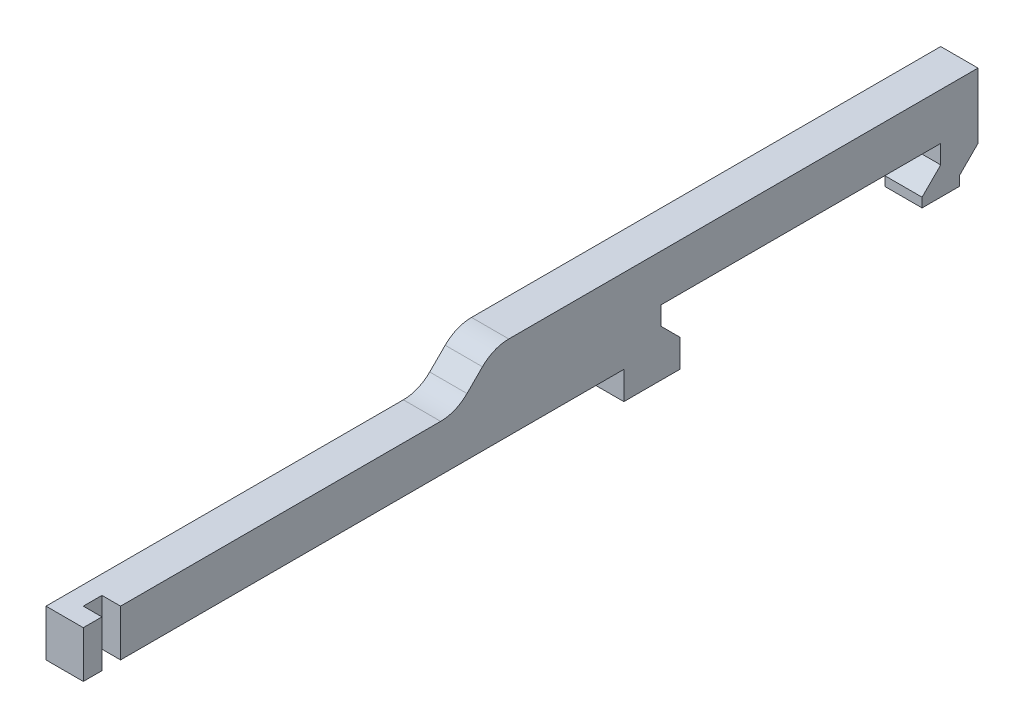
from build123d import *

# Parameters (mm, degrees)
SKETCH_1_W          = 20
SKETCH_1_H          = 2.5
EXTRUDE_1_DEPTH     = 2
FILLET_1_R          = 2
SKETCH_2_W          = 1
SKETCH_2_H          = 1
CUT_EXTRUDE_1_DEPTH = 49.207883173


with BuildPart() as part:
    # Эскиз1 → Бобышка-Вытянуть1 (new body)
    with BuildSketch(Plane(origin=(0, 0, 0), x_dir=(0, 0, -1), z_dir=(1, 0, 0))):
        Polygon((48, 1), (48, 4.5), (29, 4.5), (22, 4.5), (20, 2.5), (20, 0), (29, 0), (29, -1.5), (32, -1.5), (32, 0), (31, 1), (31, 2), (46, 2), (46, 1), (45, 0), (45, -0.5), (47, -0.5), (47, 0), align=None)
        with Locations((10, 1.25)):
            Rectangle(SKETCH_1_W, SKETCH_1_H)
    extrude(amount=EXTRUDE_1_DEPTH)

    # Скругление1
    fillet_1_edges = [part.edges().sort_by_distance(p)[0] for p in [
        (1, 2.5, -20),
        (1, 4.5, -22),
    ]]
    fillet(fillet_1_edges, radius=FILLET_1_R)

    # Эскиз2 → Вырез-Вытянуть1 (cut, through all)
    with BuildSketch(Plane(origin=(0, 2.5, 0), x_dir=(1, 0, 0), z_dir=(0, 1, 0))):
        with Locations((1.5, 1.5)):
            Rectangle(SKETCH_2_W, SKETCH_2_H)
    extrude(amount=-CUT_EXTRUDE_1_DEPTH, mode=Mode.SUBTRACT)


solid = part.part
